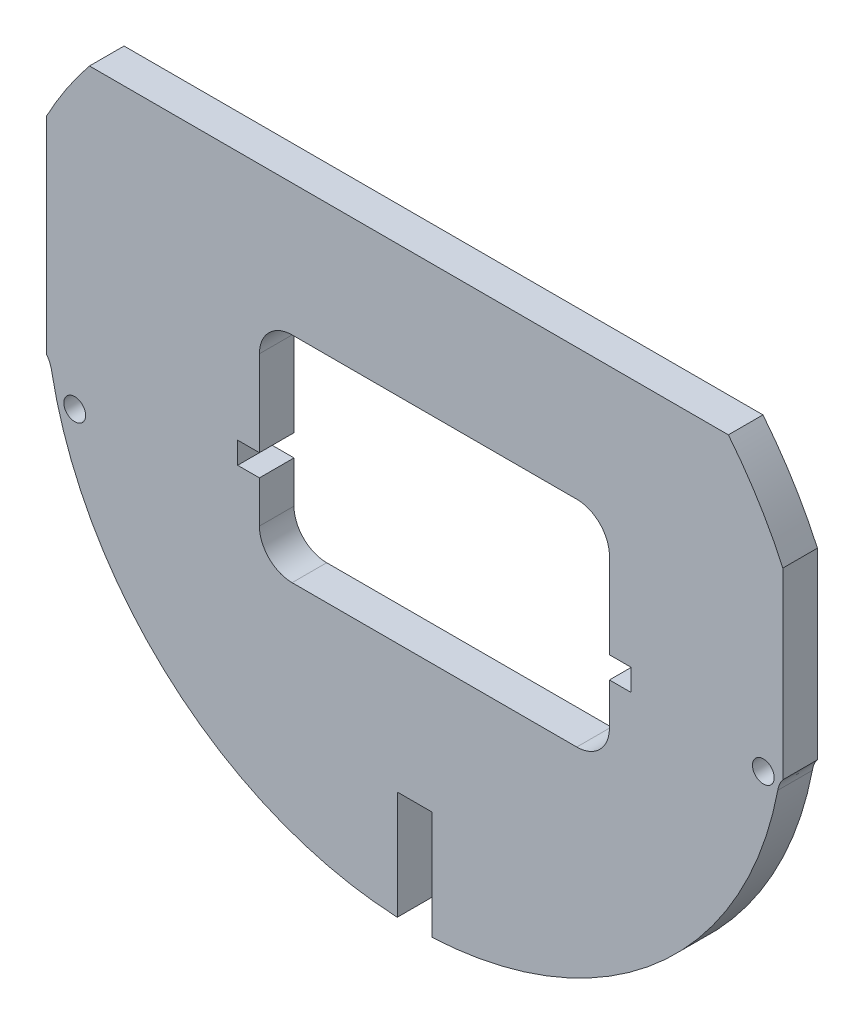
from build123d import *

# Parameters (mm, degrees)
BOSS_EXTRUDE1_DEPTH = 1.5875
SKETCH2_R           = 1
CUT_EXTRUDE1_DEPTH  = 3.175
SKETCH3_W           = 3.175
SKETCH3_H           = 10.970571453
CUT_EXTRUDE2_DEPTH  = 48.905462264
SKETCH4_W           = 2
SKETCH4_H           = 2
CUT_EXTRUDE3_DEPTH  = 48.879683973


with BuildPart() as part:
    # Sketch1 → Boss-Extrude1 (new, symmetric)
    with BuildSketch(Plane.XY):
        with BuildLine():
            Line((-29.861047016, 19.799597713), (28.798323584, 19.799597713))
            ThreePointArc((28.798323584, 19.799597713), (31.555543196, 15.909935232), (33.800017398, 11.703503281))
            Line((33.800017398, 11.703503281), (33.800017398, -5.129281896))
            add(Edge.make_bspline(
                [(33.333736062, -6.198908202), (33.370273649, -6.00495249), (33.420827163, -5.815771167), (33.570327065, -5.45389308), (33.6709127, -5.28028559), (33.800017398, -5.129281896)],
                knots=[0, 0, 0, 0, 0.5, 0.5, 1, 1, 1, 1], degree=3))
            ThreePointArc((33.333736062, -6.198908202), (-0.00068987, -33.79957838), (-33.333992426, -6.197552493))
            add(Edge.make_bspline(
                [(-33.800017403, -5.129281896), (-33.542046516, -5.431010319), (-33.407261527, -5.809359873), (-33.333992426, -6.197552493)],
                knots=[0, 0, 0, 0, 1, 1, 1, 1], degree=3))
            Line((-33.800017403, -5.129281896), (-33.800017403, 13.855371896))
            ThreePointArc((-33.800017403, 13.855371896), (-31.971328776, 16.92078434), (-29.861047016, 19.799597713))
        make_face()
    extrude(amount=BOSS_EXTRUDE1_DEPTH, both=True)

    # Sketch2 → Cut-Extrude1 (cut)
    with BuildSketch(Plane.XY.offset(1.5875)):
        with Locations((-31.216064399, -8.164436653)):
            Circle(SKETCH2_R)
        with Locations((32.009302375, -5.358989516)):
            Circle(SKETCH2_R)
    extrude(amount=-CUT_EXTRUDE1_DEPTH, mode=Mode.SUBTRACT)

    # Sketch3 → Cut-Extrude2 (cut, through all)
    with BuildSketch(Plane.XY.offset(1.5875)):
        with Locations((-0.013127042, -29.284890239)):
            Rectangle(SKETCH3_W, SKETCH3_H)
    extrude(amount=-CUT_EXTRUDE2_DEPTH, mode=Mode.SUBTRACT)

    # Sketch4 → Cut-Extrude3 (cut, through all)
    with BuildSketch(Plane.XY.offset(1.5875)):
        with BuildLine():
            Line((-14.257724699, 4.717183699), (-14.257724699, -8.984256283))
            ThreePointArc((-14.257724699, -8.984256283), (-13.379045042, -11.105576627), (-11.257724699, -11.984256283))
            Line((-11.257724699, -11.984256283), (14.878600613, -11.984256283))
            ThreePointArc((14.878600613, -11.984256283), (16.999920956, -11.105576627), (17.878600613, -8.984256283))
            Line((17.878600613, -8.984256283), (17.878600613, 4.717183699))
            ThreePointArc((17.878600613, 4.717183699), (16.999920956, 6.838504042), (14.878600613, 7.717183699))
            Line((14.878600613, 7.717183699), (-11.257724699, 7.717183699))
            ThreePointArc((-11.257724699, 7.717183699), (-13.379045042, 6.838504042), (-14.257724699, 4.717183699))
        make_face()
        with Locations((-15.257724699, -4.150157902)):
            Rectangle(SKETCH4_W, SKETCH4_H)
        with Locations((18.878600613, -4.150157902)):
            Rectangle(SKETCH4_W, SKETCH4_H)
    extrude(amount=-CUT_EXTRUDE3_DEPTH, mode=Mode.SUBTRACT)


solid = part.part
